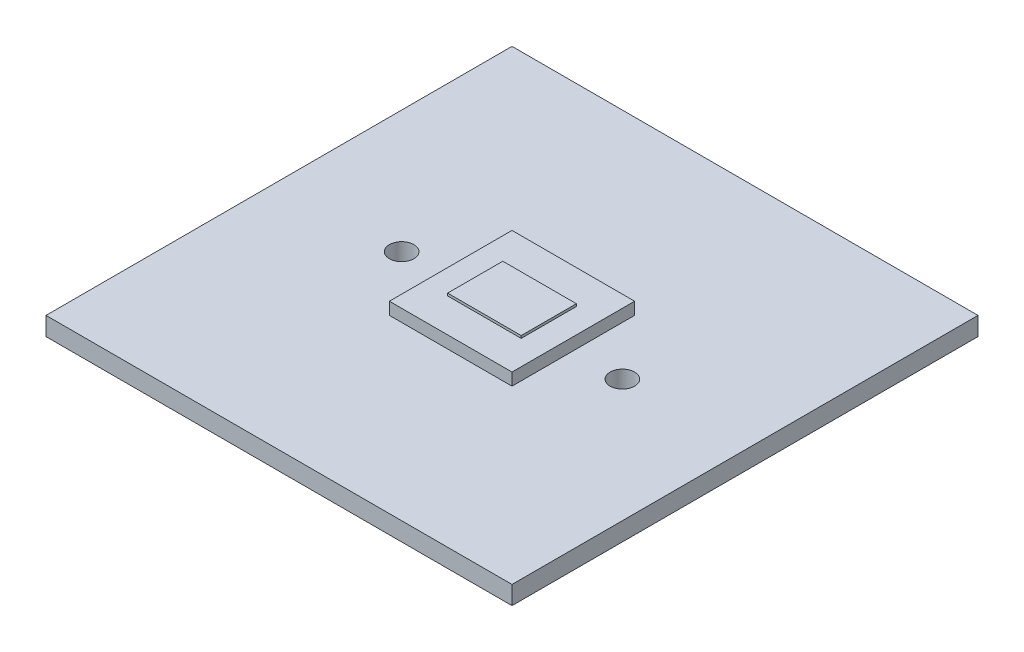
from build123d import *

# Parameters (mm, degrees)
SKETCH_1_W          = 10
SKETCH_1_H          = 10
EXTRUDE_1_DEPTH     = 1
SKETCH_2_W          = 6
SKETCH_2_H          = 4.5
EXTRUDE_2_DEPTH     = 0.2
SKETCH_3_W          = 38
SKETCH_3_H          = 38
EXTRUDE_3_DEPTH     = 1.5
SKETCH_4_R          = 1
CUT_EXTRUDE_2_DEPTH = 27.911893282


with BuildPart() as part:
    # 草图1 → 凸台-拉伸1 (new body)
    with BuildSketch(Plane(origin=(0, 0, 0), x_dir=(1, 0, 0), z_dir=(0, 1, 0))):
        Rectangle(SKETCH_1_W, SKETCH_1_H)
    extrude(amount=EXTRUDE_1_DEPTH)

    # 草图2 → 凸台-拉伸2 (add)
    with BuildSketch(Plane(origin=(0, 1, 0), x_dir=(1, 0, 0), z_dir=(0, 1, 0))):
        Rectangle(SKETCH_2_W, SKETCH_2_H)
    extrude(amount=EXTRUDE_2_DEPTH)

    # 草图3 → 凸台-拉伸3 (add)
    with BuildSketch(Plane.XZ):
        Rectangle(SKETCH_3_W, SKETCH_3_H)
    extrude(amount=EXTRUDE_3_DEPTH)

    # 草图4 → 切除-拉伸2 (cut, through all)
    with BuildSketch(Plane(origin=(0, 0, 0), x_dir=(1, 0, 0), z_dir=(0, 1, 0))):
        with Locations((9, 0)):
            Circle(SKETCH_4_R)
        with Locations((-9, 0)):
            Circle(SKETCH_4_R)
    extrude(amount=-CUT_EXTRUDE_2_DEPTH, mode=Mode.SUBTRACT)


solid = part.part
